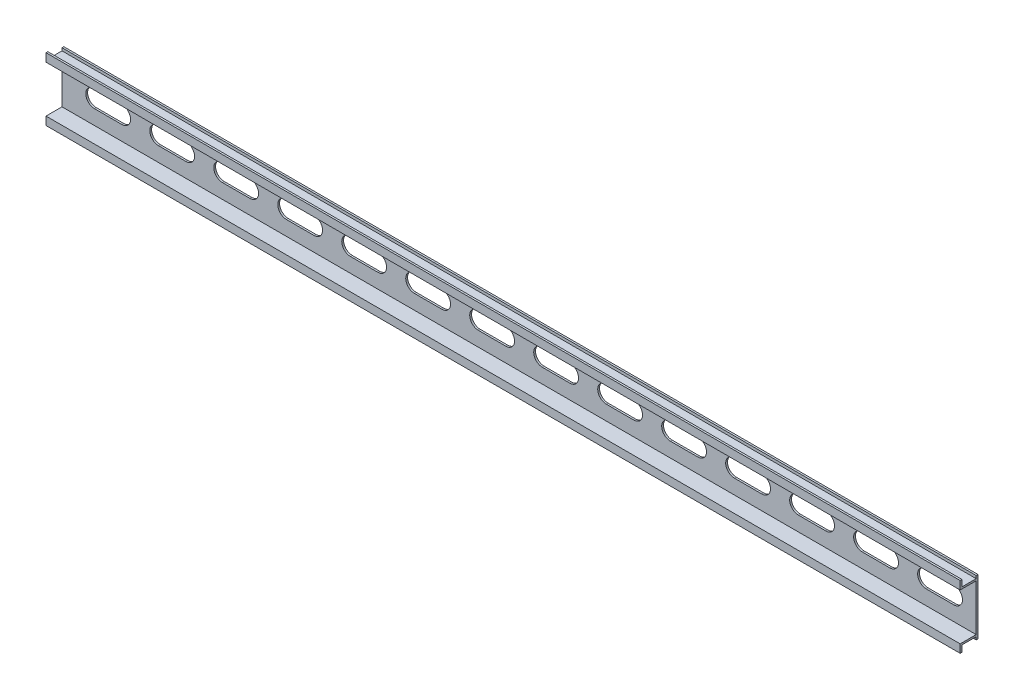
from build123d import *

# Parameters (mm, degrees)
BOSS_EXTRUDE1_DEPTH = 508
CUT_EXTRUDE1_DEPTH  = 509.398750502


with BuildPart() as part:
    # Sketch1 → Boss-Extrude1 (new body)
    with BuildSketch(Plane(origin=(0, 0, 0), x_dir=(0, 0, -1), z_dir=(1, 0, 0))):
        Polygon((0, 12.954), (0, -12.954), (-8.89, -12.954), (-8.89, -17.526), (-7.874, -17.526), (-7.874, -13.97), (0, -13.97), (0, -15.494), (1.016, -15.494), (1.016, 15.494), (0, 15.494), (0, 13.97), (-7.874, 13.97), (-7.874, 17.526), (-8.89, 17.526), (-8.89, 12.954), align=None)
    extrude(amount=BOSS_EXTRUDE1_DEPTH)

    # Sketch2 → Cut-Extrude1 (cut, through all)
    with BuildSketch(Plane(origin=(0, 0, -1.016), x_dir=(-1, 0, 0), z_dir=(0, 0, -1))):
        with BuildLine():
            Line((-495.554, 4.826), (-480.314, 4.826))
            ThreePointArc((-480.314, 4.826), (-475.488, 0), (-480.314, -4.826))
            Line((-480.314, -4.826), (-495.554, -4.826))
            ThreePointArc((-495.554, -4.826), (-500.38, 0), (-495.554, 4.826))
        make_face()
        with BuildLine():
            Line((-459.994, 4.826), (-444.754, 4.826))
            ThreePointArc((-444.754, 4.826), (-439.928, 0), (-444.754, -4.826))
            Line((-444.754, -4.826), (-459.994, -4.826))
            ThreePointArc((-459.994, -4.826), (-464.82, 0), (-459.994, 4.826))
        make_face()
        with BuildLine():
            Line((-424.434, 4.826), (-409.194, 4.826))
            ThreePointArc((-409.194, 4.826), (-404.368, 0), (-409.194, -4.826))
            Line((-409.194, -4.826), (-424.434, -4.826))
            ThreePointArc((-424.434, -4.826), (-429.26, 0), (-424.434, 4.826))
        make_face()
        with BuildLine():
            Line((-388.874, 4.826), (-373.634, 4.826))
            ThreePointArc((-373.634, 4.826), (-368.808, 0), (-373.634, -4.826))
            Line((-373.634, -4.826), (-388.874, -4.826))
            ThreePointArc((-388.874, -4.826), (-393.7, 0), (-388.874, 4.826))
        make_face()
        with BuildLine():
            Line((-353.314, 4.826), (-338.074, 4.826))
            ThreePointArc((-338.074, 4.826), (-333.248, 0), (-338.074, -4.826))
            Line((-338.074, -4.826), (-353.314, -4.826))
            ThreePointArc((-353.314, -4.826), (-358.14, 0), (-353.314, 4.826))
        make_face()
        with BuildLine():
            Line((-317.754, 4.826), (-302.514, 4.826))
            ThreePointArc((-302.514, 4.826), (-297.688, 0), (-302.514, -4.826))
            Line((-302.514, -4.826), (-317.754, -4.826))
            ThreePointArc((-317.754, -4.826), (-322.58, 0), (-317.754, 4.826))
        make_face()
        with BuildLine():
            Line((-282.194, 4.826), (-266.954, 4.826))
            ThreePointArc((-266.954, 4.826), (-262.128, 0), (-266.954, -4.826))
            Line((-266.954, -4.826), (-282.194, -4.826))
            ThreePointArc((-282.194, -4.826), (-287.02, 0), (-282.194, 4.826))
        make_face()
        with BuildLine():
            Line((-246.634, 4.826), (-231.394, 4.826))
            ThreePointArc((-231.394, 4.826), (-226.568, 0), (-231.394, -4.826))
            Line((-231.394, -4.826), (-246.634, -4.826))
            ThreePointArc((-246.634, -4.826), (-251.46, 0), (-246.634, 4.826))
        make_face()
        with BuildLine():
            Line((-211.074, 4.826), (-195.834, 4.826))
            ThreePointArc((-195.834, 4.826), (-191.008, 0), (-195.834, -4.826))
            Line((-195.834, -4.826), (-211.074, -4.826))
            ThreePointArc((-211.074, -4.826), (-215.9, 0), (-211.074, 4.826))
        make_face()
        with BuildLine():
            Line((-175.514, 4.826), (-160.274, 4.826))
            ThreePointArc((-160.274, 4.826), (-155.448, 0), (-160.274, -4.826))
            Line((-160.274, -4.826), (-175.514, -4.826))
            ThreePointArc((-175.514, -4.826), (-180.34, 0), (-175.514, 4.826))
        make_face()
        with BuildLine():
            Line((-139.954, 4.826), (-124.714, 4.826))
            ThreePointArc((-124.714, 4.826), (-119.888, 0), (-124.714, -4.826))
            Line((-124.714, -4.826), (-139.954, -4.826))
            ThreePointArc((-139.954, -4.826), (-144.78, 0), (-139.954, 4.826))
        make_face()
        with BuildLine():
            Line((-104.394, 4.826), (-89.154, 4.826))
            ThreePointArc((-89.154, 4.826), (-84.328, 0), (-89.154, -4.826))
            Line((-89.154, -4.826), (-104.394, -4.826))
            ThreePointArc((-104.394, -4.826), (-109.22, 0), (-104.394, 4.826))
        make_face()
        with BuildLine():
            Line((-68.834, 4.826), (-53.594, 4.826))
            ThreePointArc((-53.594, 4.826), (-48.768, 0), (-53.594, -4.826))
            Line((-53.594, -4.826), (-68.834, -4.826))
            ThreePointArc((-68.834, -4.826), (-73.66, 0), (-68.834, 4.826))
        make_face()
        with BuildLine():
            Line((-33.274, 4.826), (-18.034, 4.826))
            ThreePointArc((-18.034, 4.826), (-13.208, 0), (-18.034, -4.826))
            Line((-18.034, -4.826), (-33.274, -4.826))
            ThreePointArc((-33.274, -4.826), (-38.1, 0), (-33.274, 4.826))
        make_face()
    extrude(amount=-CUT_EXTRUDE1_DEPTH, mode=Mode.SUBTRACT)


solid = part.part
